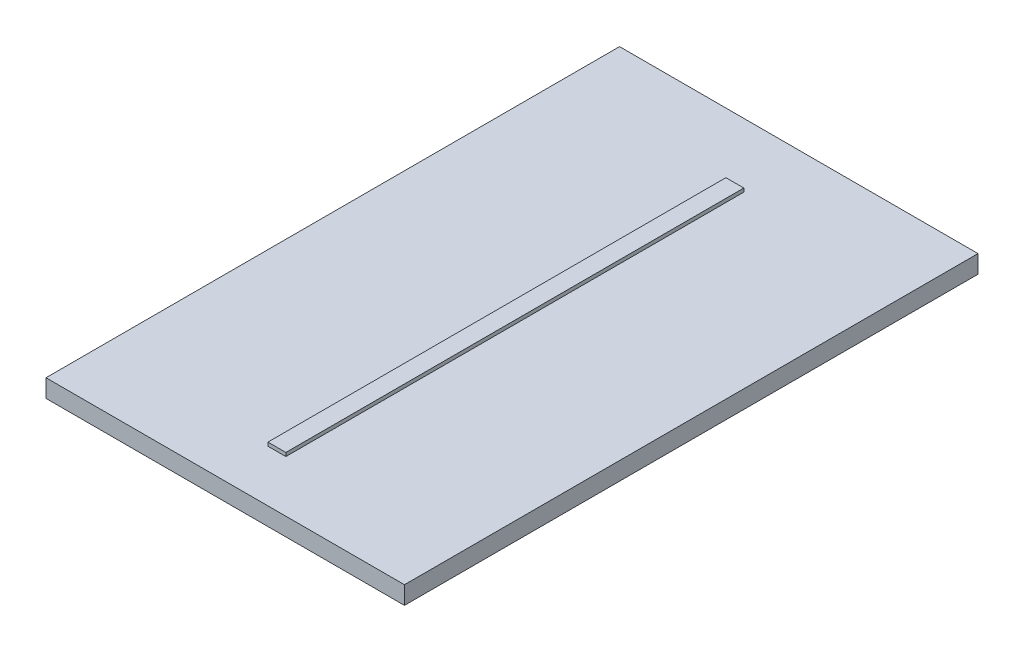
from build123d import *

# Parameters (mm, degrees)
SKETCH1_W           = 10
SKETCH1_H           = 16
BOSS_EXTRUDE1_DEPTH = 0.5
SKETCH3_W           = 0.5
SKETCH3_H           = 12.776417552
BOSS_EXTRUDE2_DEPTH = 0.1


with BuildPart() as part:
    # Sketch1 → Boss-Extrude1 (new body)
    with BuildSketch(Plane(origin=(0, 0, 0), x_dir=(1, 0, 0), z_dir=(0, 1, 0))):
        Rectangle(SKETCH1_W, SKETCH1_H)
    extrude(amount=BOSS_EXTRUDE1_DEPTH)

    # Sketch3 → Boss-Extrude2 (add)
    with BuildSketch(Plane(origin=(0, 0.5, 0), x_dir=(1, 0, 0), z_dir=(0, 1, 0))):
        with Locations((0, -0.170925653)):
            Rectangle(SKETCH3_W, SKETCH3_H)
    extrude(amount=BOSS_EXTRUDE2_DEPTH)


solid = part.part
